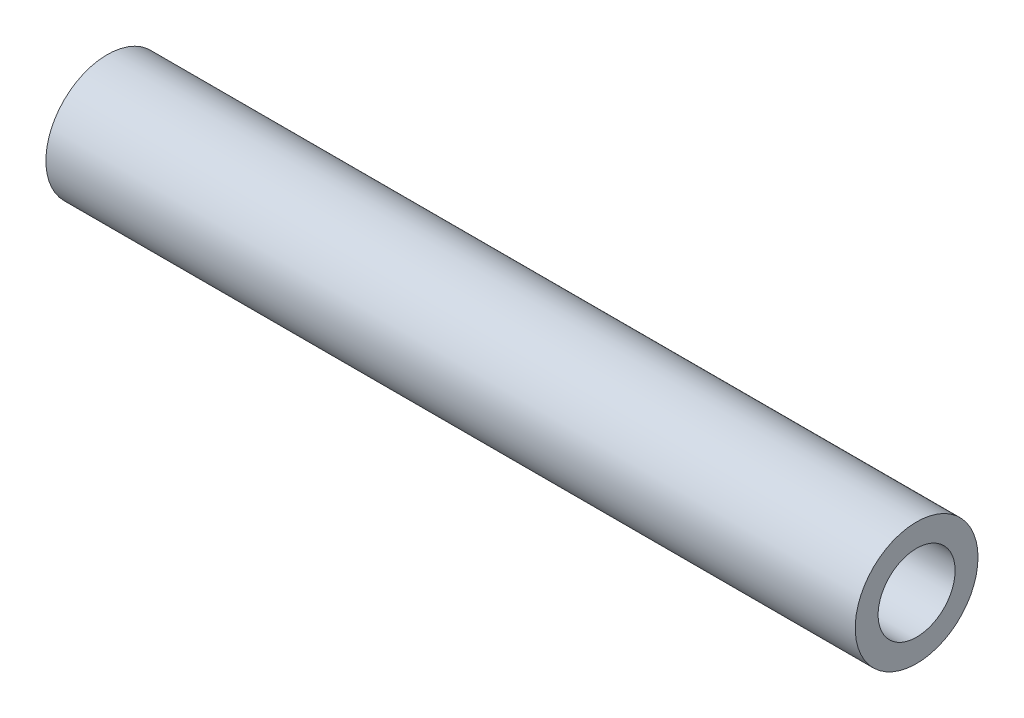
from build123d import *

# Parameters (mm, degrees)
SKETCH1_R           = 3.96875
SKETCH1_R_2         = 2.4892
BOSS_EXTRUDE1_DEPTH = 52.324


with BuildPart() as part:
    # Sketch1 → Boss-Extrude1 (new body)
    with BuildSketch(Plane(origin=(0, 0, 0), x_dir=(0, 0, -1), z_dir=(1, 0, 0))):
        Circle(SKETCH1_R)
        Circle(SKETCH1_R_2, mode=Mode.SUBTRACT)
    extrude(amount=BOSS_EXTRUDE1_DEPTH)


solid = part.part
